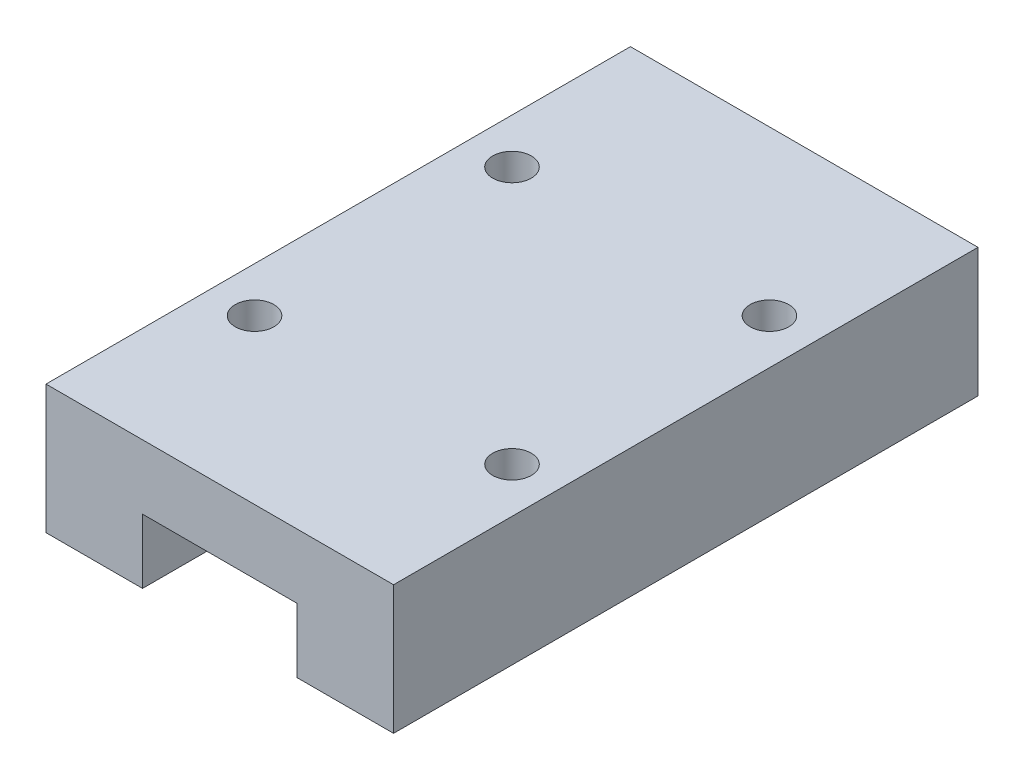
from build123d import *

# Parameters (mm, degrees)
EXTRUDE_1_DEPTH     = 45.4
SKETCH_3_R          = 1.5
CUT_EXTRUDE_1_DEPTH = 3.5


with BuildPart() as part:
    # 草图2 → 凸台-拉伸1 (new body)
    with BuildSketch(Plane.XY):
        Polygon((6, -5), (13.5, -5), (13.5, 5), (-13.5, 5), (-13.5, -5), (-6, -5), (-6, 0), (6, 0), align=None)
    extrude(amount=EXTRUDE_1_DEPTH)

    # 草图3 → 切除-拉伸1 (cut)
    with BuildSketch(Plane(origin=(0, 5, 0), x_dir=(1, 0, 0), z_dir=(0, 1, 0))):
        with Locations(Location((-10, -12.7, 0), (0, 0, 180))):
            Circle(SKETCH_3_R)
        with Locations(Location((10, -12.7, 0), (0, 0, 180))):
            Circle(SKETCH_3_R)
        with Locations(Location((10, -32.7, 0), (0, 0, 180))):
            Circle(SKETCH_3_R)
        with Locations(Location((-10, -32.7, 0), (0, 0, 180))):
            Circle(SKETCH_3_R)
    extrude(amount=-CUT_EXTRUDE_1_DEPTH, mode=Mode.SUBTRACT)


solid = part.part
